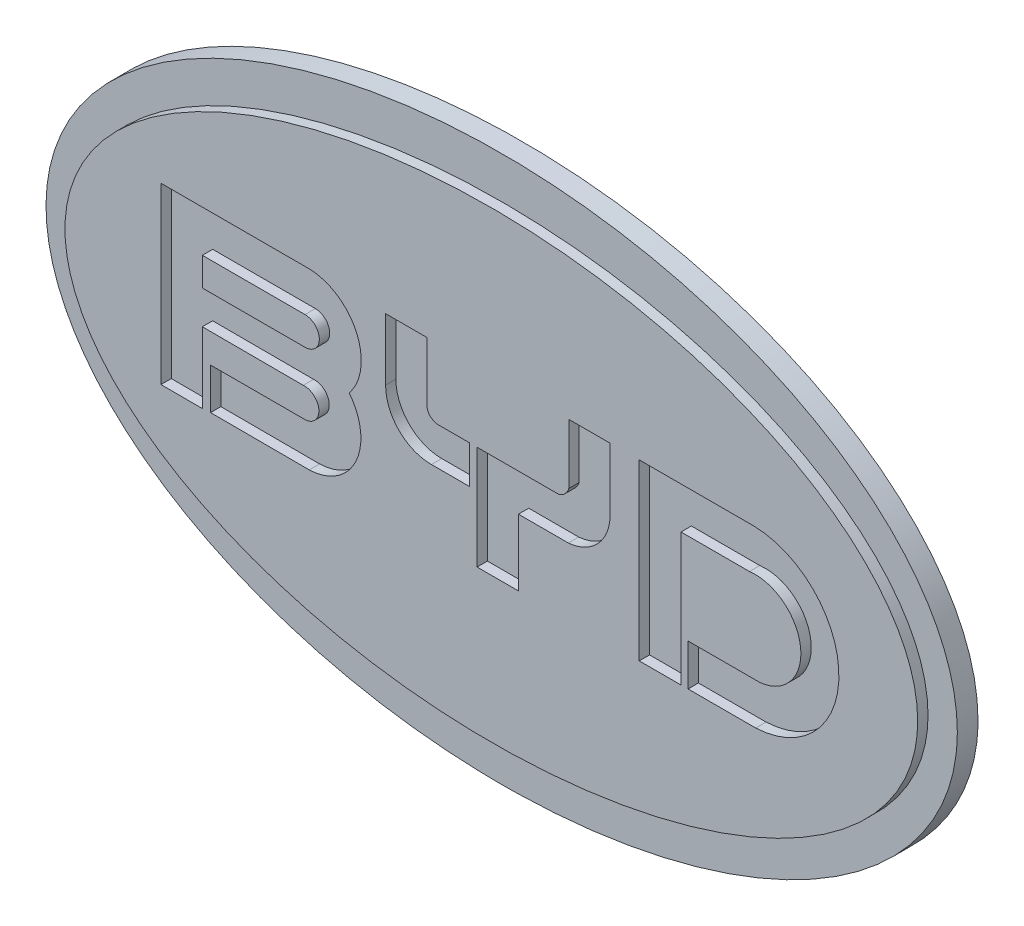
from build123d import *

# Parameters (mm, degrees)
SKETCH_3_RX         = 44.090053558
SKETCH_3_RY         = 26.443239621
EXTRUDE_1_DEPTH     = 3
CUT_EXTRUDE_START   = 3
SKETCH_3_4_RX       = 44.090053558
SKETCH_3_4_RY       = 26.443239621
SKETCH_3_4_RX_2     = 41.255952368
SKETCH_3_4_RY_2     = 22.400810242
CUT_EXTRUDE_2_DEPTH = 1


with BuildPart() as part:
    # 草图3 → 凸台-拉伸1 (new body)
    with BuildSketch(Plane.XY):
        with Locations(Location((117.824832916, 115.23790741), (0, 0, 180))):
            Ellipse(SKETCH_3_RX, SKETCH_3_RY)
    extrude(amount=EXTRUDE_1_DEPTH)

    # 草图3<4> → 切除-拉伸2 (cut)
    # profile 1 of 5: a face of its own
    with BuildSketch(Plane.XY.offset(CUT_EXTRUDE_START)):
        with Locations(Location((117.824832916, 115.23790741), (0, 0, 180))):
            Ellipse(SKETCH_3_4_RX, SKETCH_3_4_RY)
        with Locations((117.824832916, 115.23790741)):
            Ellipse(SKETCH_3_4_RX_2, SKETCH_3_4_RY_2, mode=Mode.SUBTRACT)
    # profile 2 of 5: a face of its own
    with BuildSketch(Plane.XY.offset(CUT_EXTRUDE_START)):
        with BuildLine():
            ThreePointArc((143.89906311, 119.63936615), (147.779438013, 115.207061658), (143.822433472, 110.843032837))
            Line((143.822433472, 110.843032837), (136.862030029, 110.843032837))
            Line((136.862030029, 110.843032837), (136.862030029, 106.825332642))
            Line((136.862030029, 106.825332642), (143.409423828, 106.825332642))
            ThreePointArc((143.409423828, 106.825332642), (151.457049674, 115.283053778), (143.326080322, 123.660682678))
            Line((143.326080322, 123.660682678), (132.137237549, 123.660682678))
            Line((132.137237549, 123.660682678), (132.137237549, 106.814918518))
            Line((132.137237549, 106.814918518), (136.179397583, 106.814918518))
            Line((136.179397583, 106.814918518), (136.179397583, 119.63936615))
            Line((136.179397583, 119.63936615), (142.804812511, 119.63936615))
            ThreePointArc((142.804812511, 119.63936615), (143.351937811, 119.673300221), (143.89906311, 119.63936615))
        make_face()
    # profile 3 of 5: a face of its own
    with BuildSketch(Plane.XY.offset(CUT_EXTRUDE_START)):
        with BuildLine():
            Line((124.547664698, 113.264060974), (125.282608032, 113.264060974))
            ThreePointArc((125.282608032, 113.264060974), (128.113315049, 114.623573913), (129.320327759, 117.522590637))
            Line((129.320327759, 117.522590637), (129.320327759, 123.64755249))
            Line((129.320327759, 123.64755249), (125.319236755, 123.64755249))
            Line((125.319236755, 123.64755249), (125.319236755, 117.847755432))
            ThreePointArc((125.319236755, 117.847755432), (124.968269871, 117.246162802), (124.376983643, 116.878097534))
            Line((124.376983643, 116.878097534), (116.446258545, 116.873641968))
            Line((116.446258545, 116.873641968), (116.446258545, 106.834098816))
            Line((116.446258545, 106.834098816), (120.443962097, 106.834098816))
            Line((120.443962097, 106.834098816), (120.443962097, 113.264060974))
            Line((120.443962097, 113.264060974), (124.547664698, 113.264060974))
        make_face()
    # profile 4 of 5: a face of its own
    with BuildSketch(Plane.XY.offset(CUT_EXTRUDE_START)):
        with BuildLine():
            ThreePointArc((111.588310242, 117.898681641), (111.937267918, 117.178522683), (112.678985596, 116.878097534))
            Line((112.678985596, 116.878097534), (115.696937561, 116.878097534))
            Line((115.696937561, 116.878097534), (115.696937561, 113.216255188))
            Line((115.696937561, 113.216255188), (112.02633667, 113.216255188))
            ThreePointArc((112.02633667, 113.216255188), (108.882327189, 114.5074245), (107.595947266, 117.653396606))
            Line((107.595947266, 117.653396606), (107.595947266, 123.64239502))
            Line((107.595947266, 123.64239502), (111.588310242, 123.64239502))
            Line((111.588310242, 123.64239502), (111.588310242, 117.898681641))
        make_face()
    # profile 5 of 5: a face of its own
    with BuildSketch(Plane.XY.offset(CUT_EXTRUDE_START)):
        with BuildLine():
            Line((100.320487976, 123.701698303), (85.857902527, 123.701698303))
            Line((85.857902527, 123.701698303), (85.857902527, 106.831474304))
            Line((85.857902527, 106.831474304), (89.85785675, 106.821266174))
            Line((89.85785675, 106.821266174), (89.85785675, 113.6771698))
            Line((89.85785675, 113.6771698), (99.629045068, 113.652244725))
            ThreePointArc((99.629045068, 113.652244725), (99.745733087, 113.656821169), (99.86239624, 113.651649475))
            ThreePointArc((99.86239624, 113.651649475), (101.141097708, 112.257892609), (99.86239624, 110.864135742))
            ThreePointArc((99.86239624, 110.864135742), (99.742164596, 110.858959497), (99.621932952, 110.864135742))
            Line((99.621932952, 110.864135742), (90.656356812, 110.864135742))
            Line((90.656356812, 110.864135742), (90.656356812, 106.879867554))
            Line((90.656356812, 106.879867554), (99.860228116, 106.856387052))
            Line((99.860228116, 106.856387052), (100.208221436, 106.855499268))
            ThreePointArc((100.208221436, 106.855499268), (104.731739573, 109.852213429), (104.070821683, 115.23790741))
            ThreePointArc((104.070821683, 115.23790741), (104.793856796, 120.621074732), (100.320487976, 123.701698303))
        make_face()
        with BuildLine():
            Line((89.865707397, 116.923698425), (89.865707397, 119.666885376))
            Line((89.865707397, 119.666885376), (99.797425153, 119.666885376))
            Line((99.797425153, 119.666885376), (99.823417664, 119.666885376))
            ThreePointArc((99.823417664, 119.666885376), (101.182014946, 118.28271099), (99.798248291, 116.923698425))
            Line((99.798248291, 116.923698425), (89.865707397, 116.923698425))
        make_face(mode=Mode.SUBTRACT)
    extrude(amount=-CUT_EXTRUDE_2_DEPTH, mode=Mode.SUBTRACT)


solid = part.part
